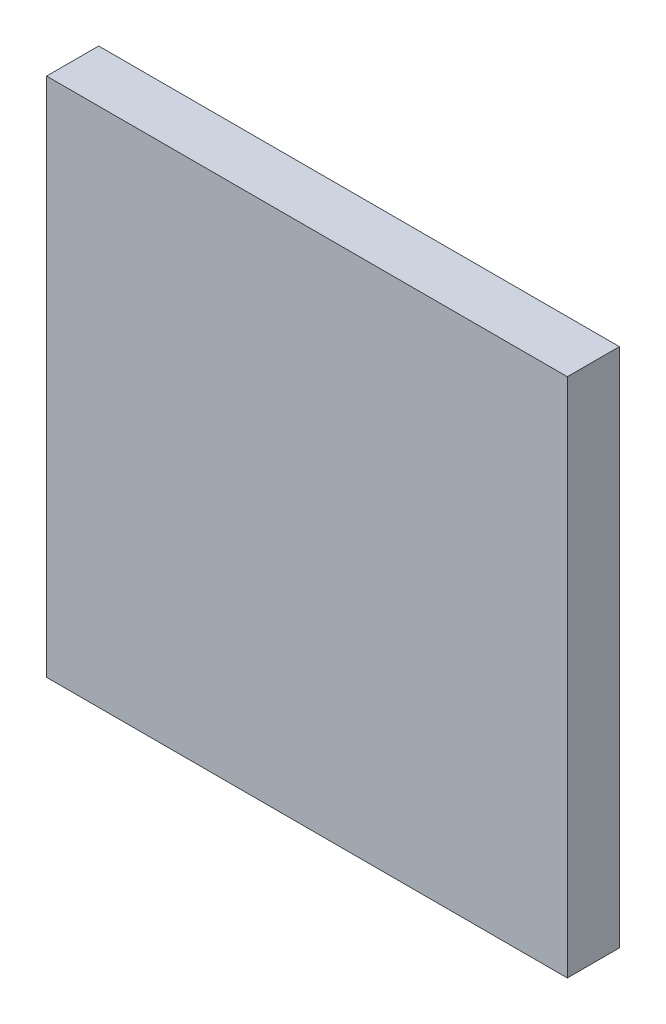
from build123d import *

# Parameters (mm, degrees)
SKETCH1_W      = 100
SKETCH1_H      = 100
EXTRUDE1_DEPTH = 10


with BuildPart() as part:
    # Sketch1 → Extrude1 (new body)
    with BuildSketch(Plane.XY):
        with Locations((50, 50)):
            Rectangle(SKETCH1_W, SKETCH1_H)
    extrude(amount=EXTRUDE1_DEPTH)


solid = part.part
